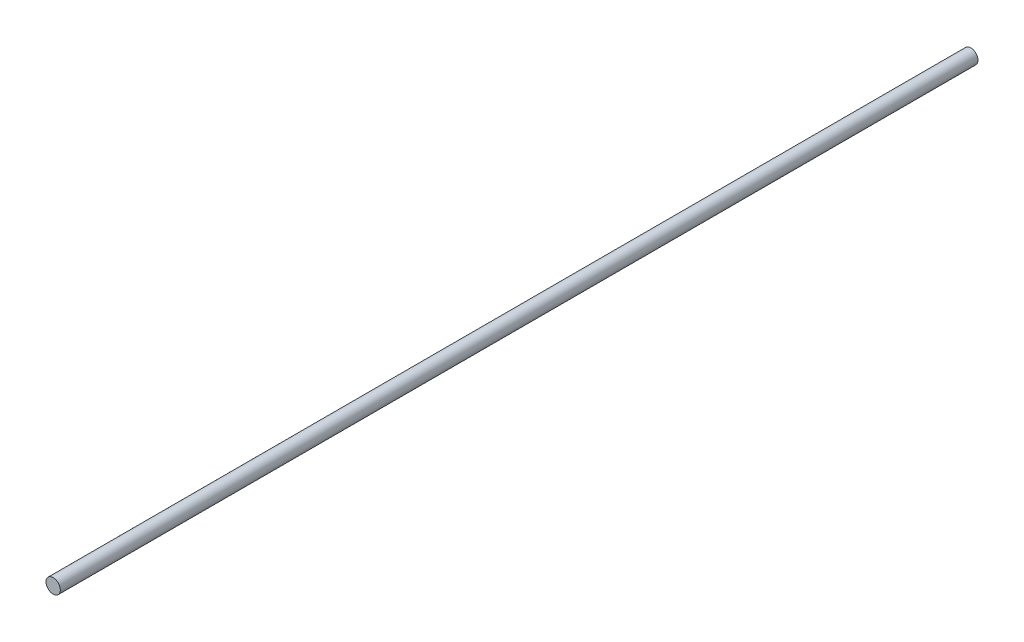
from build123d import *

# Parameters (mm, degrees)
SKETCH1_R           = 1.5875
BOSS_EXTRUDE1_DEPTH = 203.2


with BuildPart() as part:
    # Sketch1 → Boss-Extrude1 (new body)
    with BuildSketch(Plane.XY):
        Circle(SKETCH1_R)
    extrude(amount=BOSS_EXTRUDE1_DEPTH)


solid = part.part
